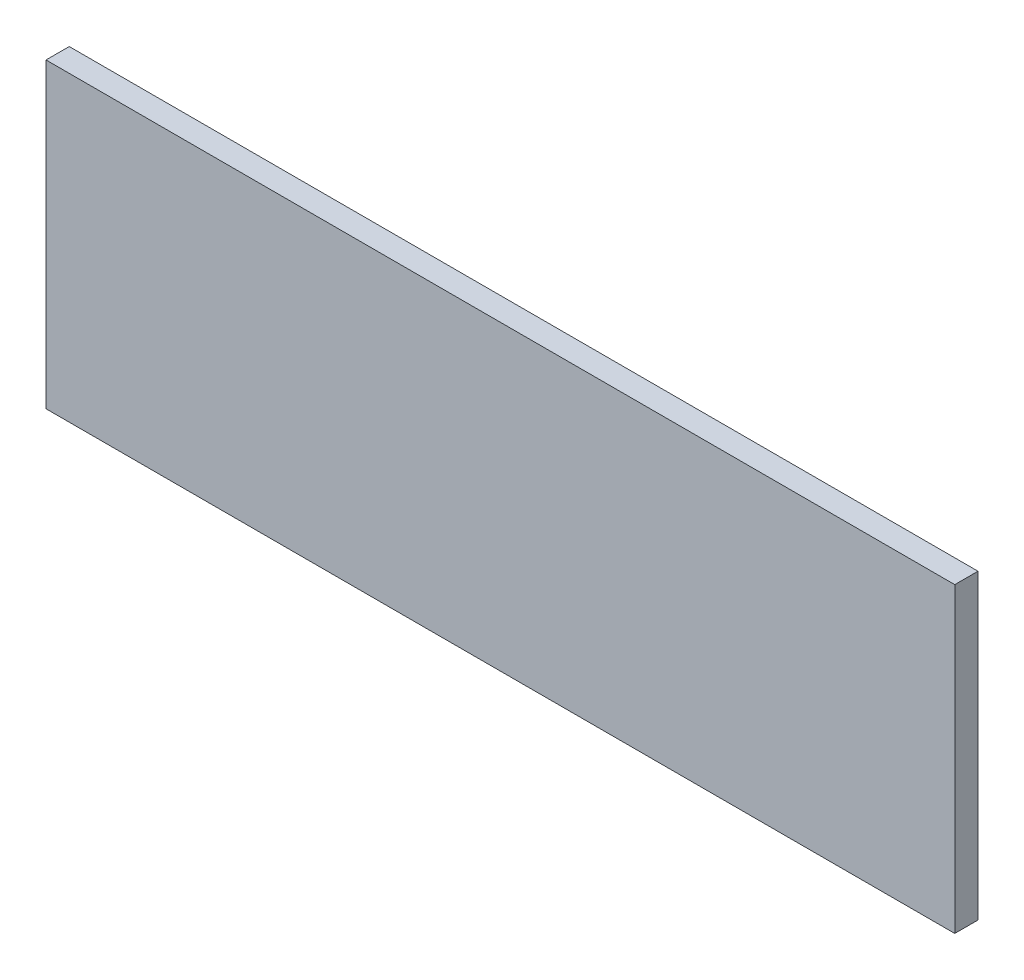
from build123d import *

# Parameters (mm, degrees)
SKETCH1_W           = 78.24
SKETCH1_H           = 26.01
BOSS_EXTRUDE1_DEPTH = 2


with BuildPart() as part:
    # Sketch1 → Boss-Extrude1 (new body)
    with BuildSketch(Plane.XY):
        Rectangle(SKETCH1_W, SKETCH1_H)
    extrude(amount=BOSS_EXTRUDE1_DEPTH)


solid = part.part
